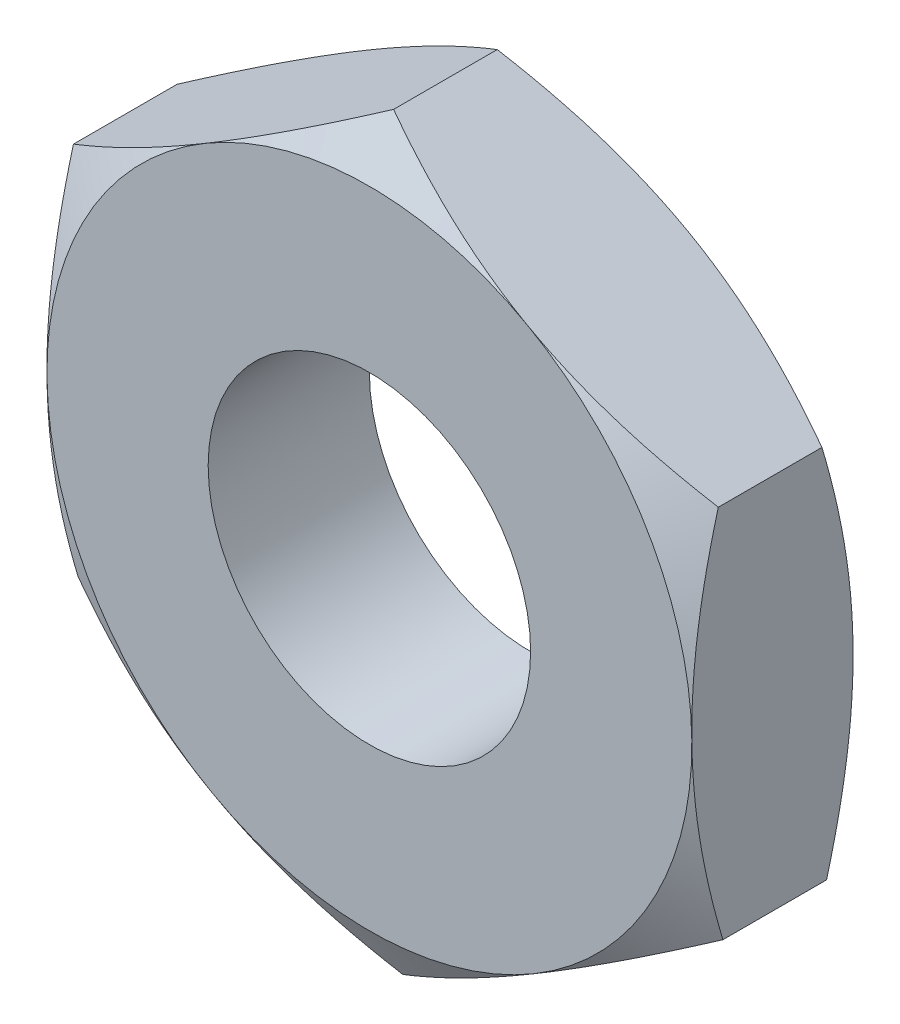
from build123d import *

# Parameters (mm, degrees)
SKETCH1_R               = 5
BOSS_EXTRUDE1_DEPTH     = 2.5
SKETCH2_OUTSIDE_W       = 45.67
SKETCH2_OUTSIDE_H       = 48.622
SKETCH2_OUTSIDE_R       = 10
CUT_EXTRUDE1_DEPTH      = 5
CUT_EXTRUDE1_DRAFT      = -60
MIRROR1_COPY_1_SKETCH_W = 45.67
MIRROR1_COPY_1_SKETCH_H = 48.622
MIRROR1_COPY_1_SKETCH_R = 10
MIRROR1_COPY_1_DEPTH    = 5
MIRROR1_COPY_1_DRAFT    = -60


with BuildPart() as part:
    # Sketch1 → Boss-Extrude1 (new, symmetric)
    with BuildSketch(Plane.XY):
        Polygon((10.070240353, -5.650096687), (9.928247441, 5.896035625), (-0.141992912, 11.546132311), (-10.070240353, 5.650096687), (-9.928247441, -5.896035625), (0.141992912, -11.546132311), align=None)
        Circle(SKETCH1_R, mode=Mode.SUBTRACT)
    extrude(amount=BOSS_EXTRUDE1_DEPTH, both=True)


with BuildPart() as cut_extrude1_tool:
    # Sketch2 outside → Cut-Extrude1 (with draft: the straight prism first)
    with BuildSketch(Plane.XY.offset(2.5)):
        Rectangle(SKETCH2_OUTSIDE_W, SKETCH2_OUTSIDE_H)
        Circle(SKETCH2_OUTSIDE_R, mode=Mode.SUBTRACT)
    extrude(amount=-CUT_EXTRUDE1_DEPTH)
    # Cut-Extrude1: the draft: its side faces are tilted about the plane it starts from
    cut_extrude1_sides = [cut_extrude1_tool.faces().sort_by_distance(p)[0] for p in [
        (0, -24.311, 0),
        (22.835, 0, 0),
        (0, 24.311, 0),
        (-22.835, 0, 0),
        (-10, 0, 0),
    ]]
    draft(cut_extrude1_sides, Plane.XY.offset(2.5), CUT_EXTRUDE1_DRAFT)


with BuildPart() as part_1:
    add(part.part)

    # Cut-Extrude1: cut by cut_extrude1_tool
    add(cut_extrude1_tool.part, mode=Mode.SUBTRACT)


with BuildPart() as mirror1_copy_1_tool:
    # Mirror1 copy 1 sketch → Mirror1 copy 1 (with draft: the straight prism first)
    with BuildSketch(Plane(origin=(0, 0, -2.5), x_dir=(1, 0, 0), z_dir=(0, 0, -1))):
        Rectangle(MIRROR1_COPY_1_SKETCH_W, MIRROR1_COPY_1_SKETCH_H)
        Circle(MIRROR1_COPY_1_SKETCH_R, mode=Mode.SUBTRACT)
    extrude(amount=-MIRROR1_COPY_1_DEPTH)
    # Mirror1 copy 1: the draft: its side faces are tilted about the plane it starts from
    mirror1_copy_1_sides = [mirror1_copy_1_tool.faces().sort_by_distance(p)[0] for p in [
        (0, -24.311, 0),
        (22.835, 0, 0),
        (0, 24.311, 0),
        (-22.835, 0, 0),
        (-10, 0, 0),
    ]]
    draft(mirror1_copy_1_sides, Plane(origin=(0, 0, -2.5), x_dir=(1, 0, 0), z_dir=(0, 0, -1)), MIRROR1_COPY_1_DRAFT)


with BuildPart() as part_2:
    add(part_1.part)

    # Mirror1 copy 1: cut by mirror1_copy_1_tool
    add(mirror1_copy_1_tool.part, mode=Mode.SUBTRACT)


solid = part_2.part
